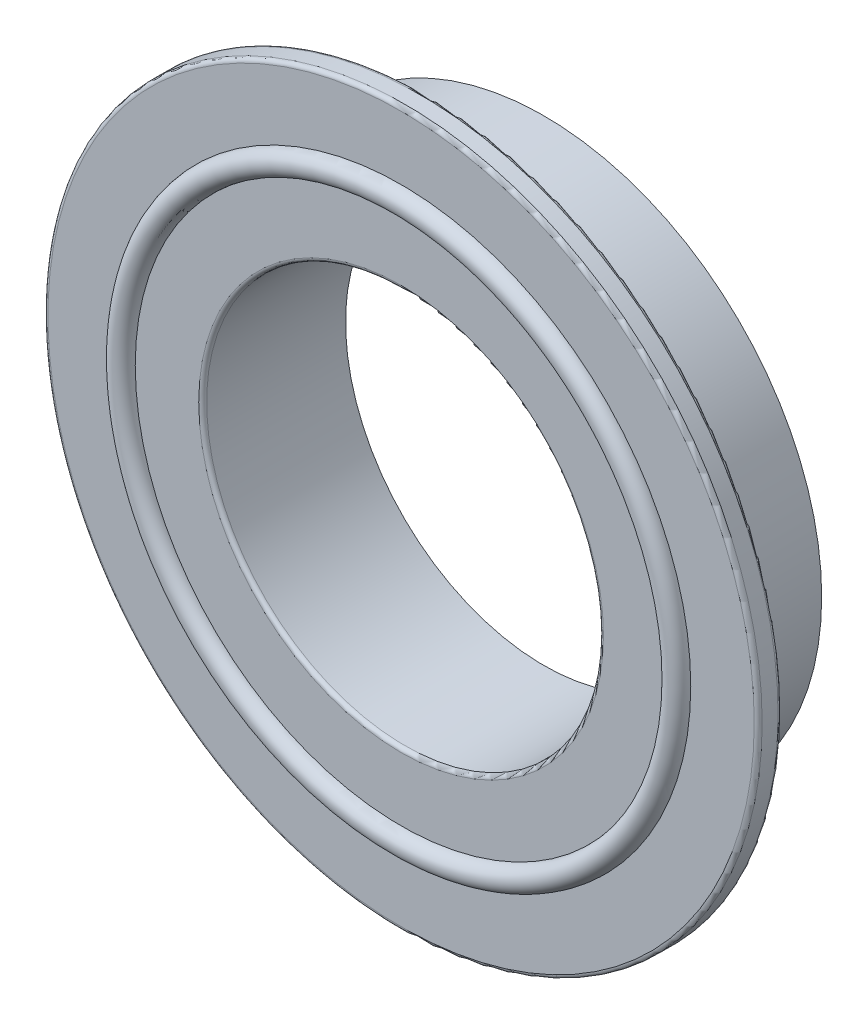
from build123d import *

# Parameters (mm, degrees)
SKETCH1_R           = 35
SKETCH1_R_2         = 25
BOSS_EXTRUDE1_DEPTH = 15
BOSS_EXTRUDE2_START = 3
SKETCH2_R           = 45
SKETCH2_R_2         = 25
BOSS_EXTRUDE2_DEPTH = 3
SKETCH3_R           = 1.5
FILLET1_R           = 0.5


with BuildPart() as part:
    # Sketch1 → Boss-Extrude1 (new body)
    with BuildSketch(Plane(origin=(0, 0, 0), x_dir=(0, 1, 0), z_dir=(0, 0, 1))):
        with Locations(Location((0, 0, 0), (0, 0, 270))):
            Circle(SKETCH1_R)
        with Locations(Location((0, 0, 0), (0, 0, 270))):
            Circle(SKETCH1_R_2, mode=Mode.SUBTRACT)
    extrude(amount=-BOSS_EXTRUDE1_DEPTH)

    # Sketch2 → Boss-Extrude2 (add)
    with BuildSketch(Plane.XY.offset(BOSS_EXTRUDE2_START)):
        Circle(SKETCH2_R)
        Circle(SKETCH2_R_2, mode=Mode.SUBTRACT)
    extrude(amount=-BOSS_EXTRUDE2_DEPTH)

    # Sketch3 → Revolve1 (revolve)
    with BuildSketch(Plane.YZ, mode=Mode.PRIVATE) as revolve1_sk:
        with Locations((-35, 3)):
            Circle(SKETCH3_R)
    revolve(revolve1_sk.sketch.rotate(Axis((0, 0, 13.091516213), (0, 0, -1)), 270), axis=Axis((0, 0, 13.091516213), (0, 0, -1)))

    # Fillet1
    fillet1_edges = [part.edges().sort_by_distance(p)[0] for p in [
        (-45, 0, 3),
        (-45, 0, 0),
        (-25, 0, 3),
    ]]
    fillet(fillet1_edges, radius=FILLET1_R)


solid = part.part
